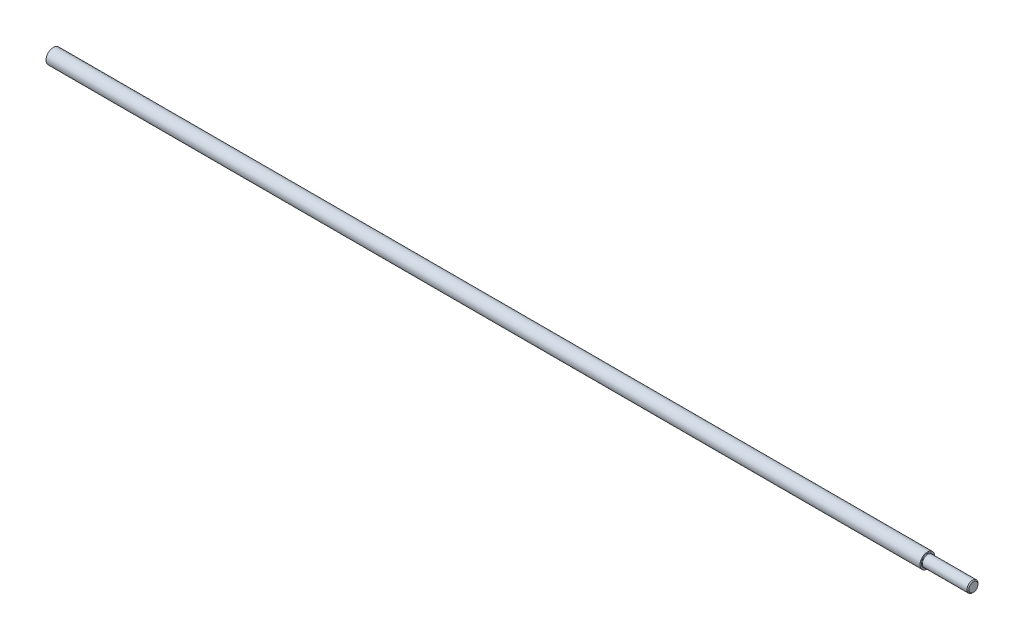
from build123d import *


with BuildPart() as part:
    # Sketch1 → Revolve1 (revolve)
    with BuildSketch(Plane.XY, mode=Mode.PRIVATE) as revolve1_sk:
        with BuildLine():
            Line((0, 4), (0, 0))
            Line((0, 0), (500, 0))
            Line((500, 0), (500, 2.5))
            Line((500, 2.5), (499.5, 3))
            Line((499.5, 3), (475.3, 3))
            ThreePointArc((475.3, 3), (475.087867966, 3.087867966), (475, 3.3))
            Line((475, 3.3), (475, 4))
            Line((475, 4), (0, 4))
        make_face()
    revolve(revolve1_sk.sketch.rotate(Axis((0, 0, 0), (1, 0, 0)), 270), axis=Axis((0, 0, 0), (1, 0, 0)))


solid = part.part
